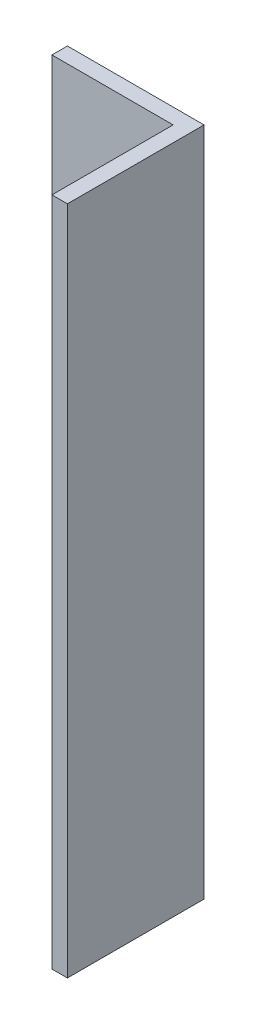
from build123d import *

# Parameters (mm, degrees)
BOSS_EXTRUDE1_DEPTH = 130


with BuildPart() as part:
    # Sketch1 → Boss-Extrude1 (new body)
    with BuildSketch(Plane(origin=(0, 0, 0), x_dir=(1, 0, 0), z_dir=(0, 1, 0))):
        Polygon((0, 0), (26.5, 0), (26.5, -26.5), (23.5, -26.5), (23.5, -3), (0, -3), align=None)
    extrude(amount=BOSS_EXTRUDE1_DEPTH)


solid = part.part
